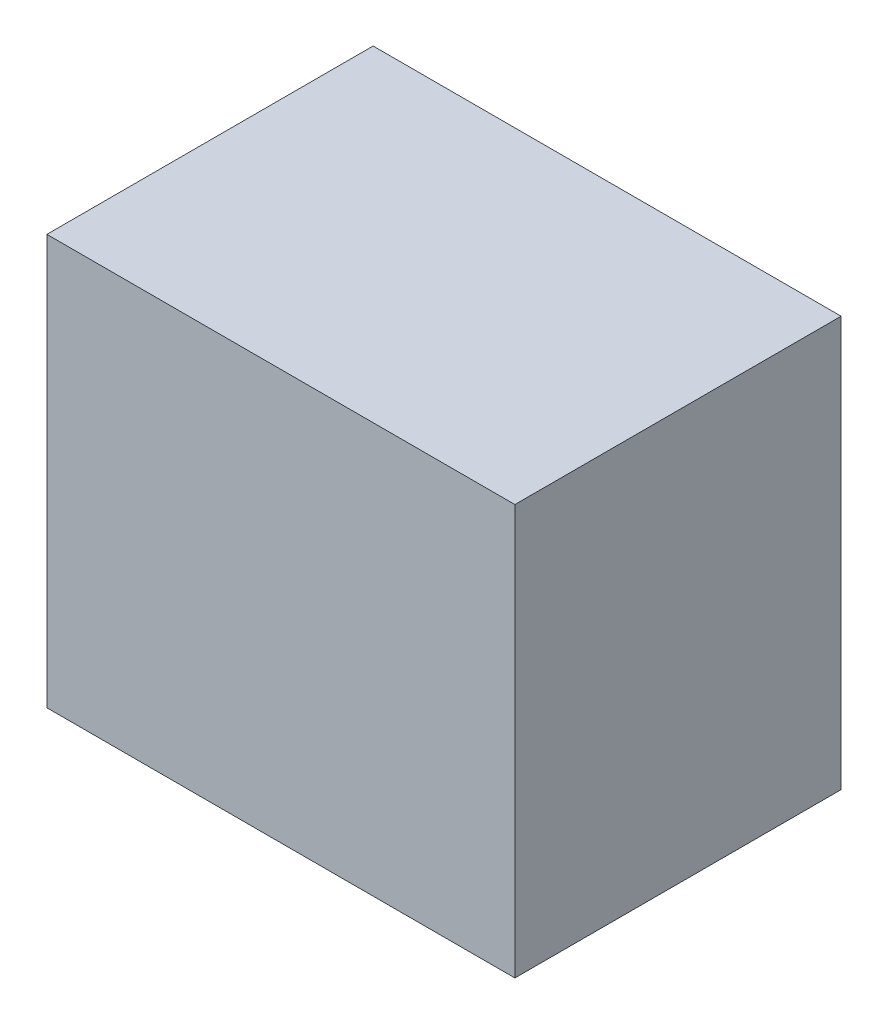
from build123d import *

# Parameters (mm, degrees)
SKETCH1_W           = 28.78621905
SKETCH1_H           = 25.220953388
BOSS_EXTRUDE1_DEPTH = 20.066


with BuildPart() as part:
    # Sketch1 → Boss-Extrude1 (new body)
    with BuildSketch(Plane.XY):
        with Locations((14.393109525, 12.610476694)):
            Rectangle(SKETCH1_W, SKETCH1_H)
    extrude(amount=BOSS_EXTRUDE1_DEPTH)


solid = part.part
